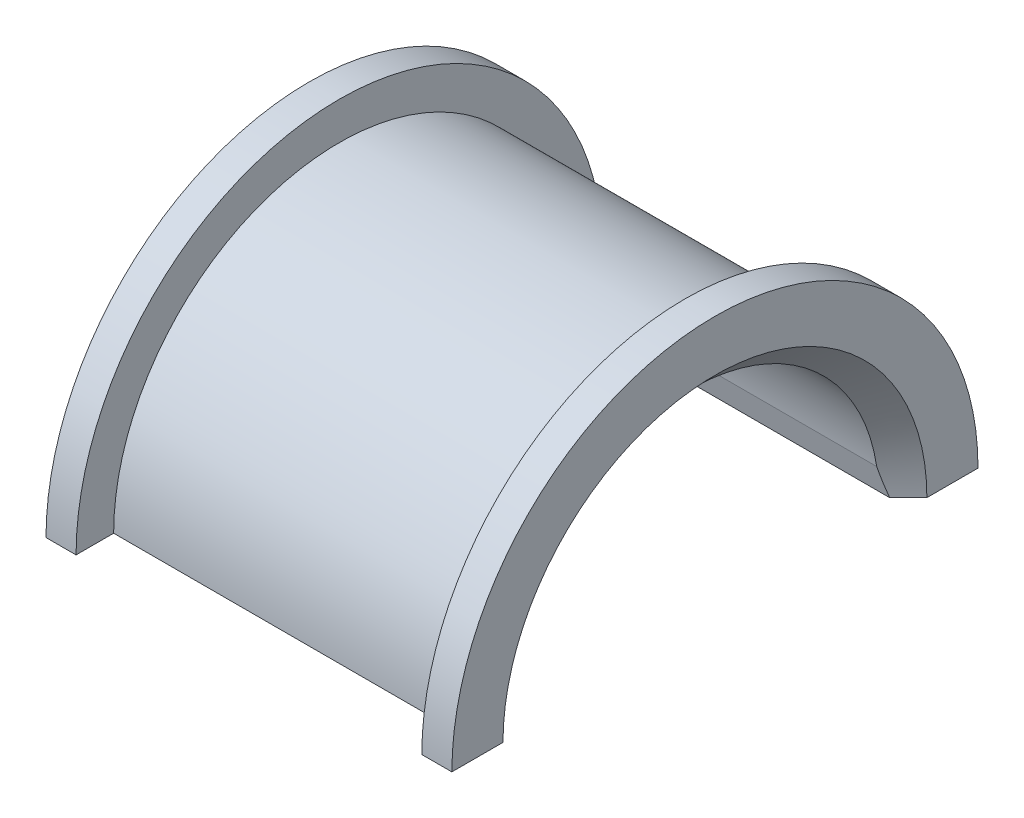
from build123d import *

# Parameters (mm, degrees)
REVOLVE_1_ANGLE     = 180
CUT_EXTRUDE_1_DEPTH = 37.626493144


with BuildPart() as part:
    # Эскиз1 → Повернуть1 (revolve, symmetric)
    with BuildSketch(Plane.XY) as revolve_1_sk:
        Polygon((0, 14.1), (0, 17.5), (2, 17.5), (2, 15), (25, 15), (25, 17.5), (27, 17.5), (27, 14.1), (25.4, 12.5), (1.6, 12.5), align=None)
    revolve(axis=Axis((-27.195971024, 0, 0), (1, 0, 0)), revolution_arc=REVOLVE_1_ANGLE / 2)
    revolve(revolve_1_sk.sketch, axis=Axis((-27.195971024, 0, 0), (-1, 0, 0)), revolution_arc=REVOLVE_1_ANGLE / 2)

    # Эскиз2 → Вырез-Вытянуть1 (cut, through all)
    with BuildSketch(Plane.ZY):
        Polygon((12.85993322, 0), (12.35993322, 1.866025404), (12.35993322, 0), align=None)
        Polygon((-12.85993322, 0), (-12.35993322, 1.866025404), (-12.35993322, 0), align=None)
    extrude(amount=-CUT_EXTRUDE_1_DEPTH, mode=Mode.SUBTRACT)


solid = part.part
